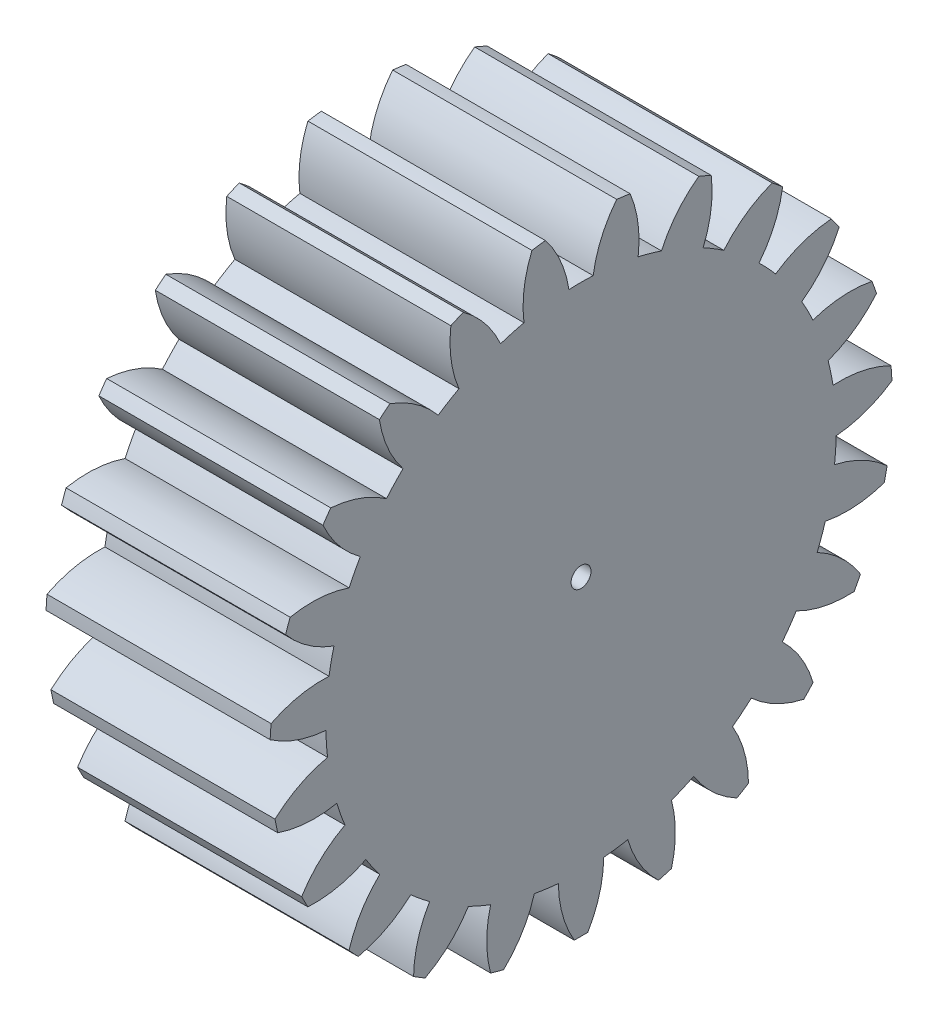
from build123d import *

# Parameters (mm, degrees)
BASPROSKE_W     = 9
BASPROSKE_H     = 12.5
TOOTHCUT_DEPTH  = 20.836834425
TEETHCUTS_COUNT = 23
TEETHCUTS_ANGLE = 344.347826087
BORSKE_R        = 0.4
BORE_DEPTH      = 50.0000508


with BuildPart() as part:
    # BasProSke → Base-Revolve (revolve)
    with BuildSketch(Plane(origin=(0, 0, 0), x_dir=(1, 0, 0), z_dir=(0, 1, 0)), mode=Mode.PRIVATE) as base_revolve_sk:
        with Locations((4.5, 6.25)):
            Rectangle(BASPROSKE_W, BASPROSKE_H)
    revolve(base_revolve_sk.sketch.rotate(Axis((-10, 0, 0), (1, 0, 0)), 180), axis=Axis((-10, 0, 0), (1, 0, 0)))

    # TooCutSke → ToothCut (cut, through all)
    with BuildSketch(Plane(origin=(0, 0, 0), x_dir=(0, 0, -1), z_dir=(1, 0, 0))):
        with BuildLine():
            ThreePointArc((0.487075069, 10.237419542), (0, 10.249), (-0.487075069, 10.237419542))
            ThreePointArc((-0.487075069, 10.237419542), (-0.822200209, 11.403353821), (-1.450473694, 12.441132232))
            ThreePointArc((-1.450473694, 12.441132232), (0, 12.5254), (1.450473694, 12.441132232))
            ThreePointArc((1.450473694, 12.441132232), (0.822200209, 11.403353821), (0.487075069, 10.237419542))
        make_face()
    toothcut = extrude(amount=TOOTHCUT_DEPTH, mode=Mode.SUBTRACT)

    # TeethCuts: ToothCut ×23 about axis
    teethcuts_axis = Axis((-10, 0, 0), (1, 0, 0))
    for i in range(1, TEETHCUTS_COUNT):
        add(toothcut.rotate(teethcuts_axis, i * TEETHCUTS_ANGLE / (TEETHCUTS_COUNT - 1)), mode=Mode.SUBTRACT)

    # BorSke → Bore (cut, symmetric)
    with BuildSketch(Plane(origin=(0, 0, 0), x_dir=(0, 0, -1), z_dir=(1, 0, 0))):
        with Locations(Location((0, 0, 0), (0, 0, 180))):
            Circle(BORSKE_R)
    extrude(amount=BORE_DEPTH, both=True, mode=Mode.SUBTRACT)


solid = part.part
